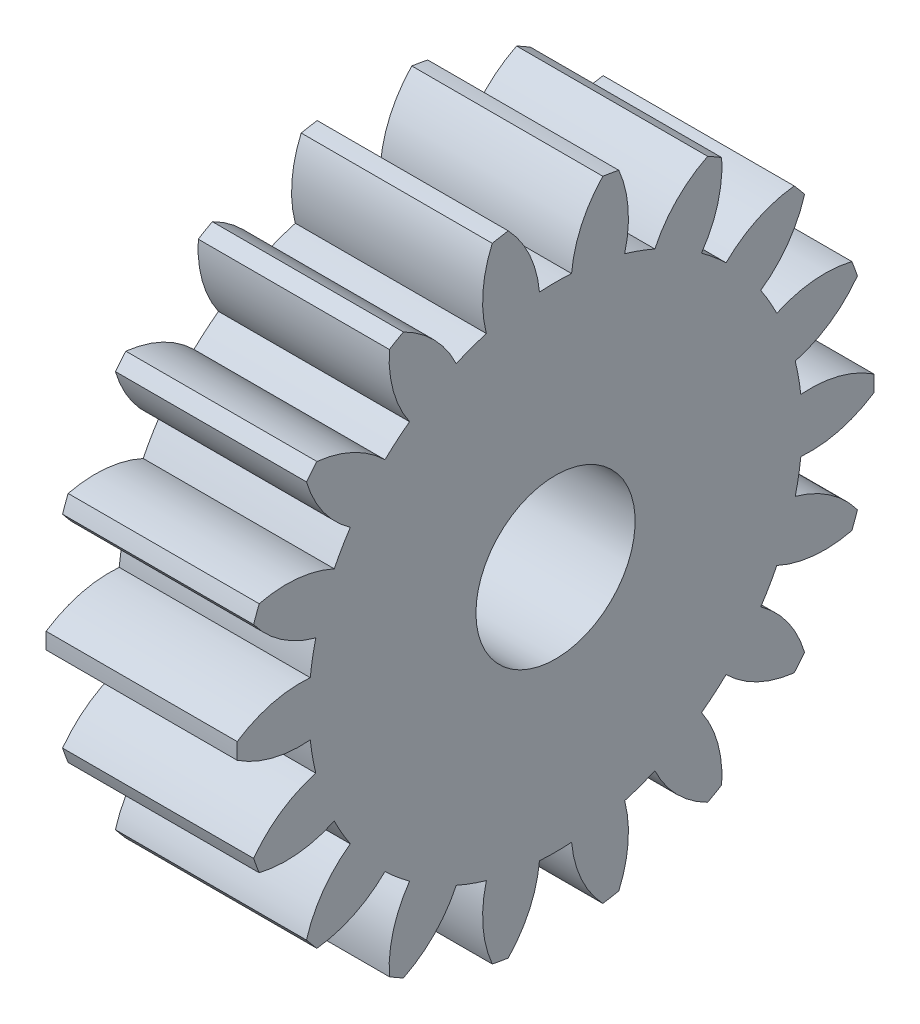
from build123d import *

# Parameters (mm, degrees)
BASPROSKE_W     = 12
BASPROSKE_H     = 20
TOOTHCUT_DEPTH  = 31.724582991
TEETHCUTS_COUNT = 18
TEETHCUTS_ANGLE = 340
BORSKE_R        = 5
BORE_DEPTH      = 50.0000508


with BuildPart() as part:
    # BasProSke → Base-Revolve (revolve)
    with BuildSketch(Plane(origin=(0, 0, 0), x_dir=(1, 0, 0), z_dir=(0, 1, 0)), mode=Mode.PRIVATE) as base_revolve_sk:
        with Locations((6, 10)):
            Rectangle(BASPROSKE_W, BASPROSKE_H)
    revolve(base_revolve_sk.sketch.rotate(Axis((-10, 0, 0), (1, 0, 0)), 180), axis=Axis((-10, 0, 0), (1, 0, 0)))

    # TooCutSke → ToothCut (cut, through all)
    with BuildSketch(Plane(origin=(0, 0, 0), x_dir=(0, 0, -1), z_dir=(1, 0, 0))):
        with BuildLine():
            ThreePointArc((1.007799284, 15.466199973), (0, 15.499), (-1.007799284, 15.466199973))
            ThreePointArc((-1.007799284, 15.466199973), (-1.630454606, 17.802374148), (-2.991345877, 19.800719558))
            ThreePointArc((-2.991345877, 19.800719558), (0, 20.0254), (2.991345877, 19.800719558))
            ThreePointArc((2.991345877, 19.800719558), (1.630454606, 17.802374148), (1.007799284, 15.466199973))
        make_face()
    toothcut = extrude(amount=TOOTHCUT_DEPTH, mode=Mode.SUBTRACT)

    # TeethCuts: ToothCut ×18 about axis
    teethcuts_axis = Axis((-10, 0, 0), (1, 0, 0))
    for i in range(1, TEETHCUTS_COUNT):
        add(toothcut.rotate(teethcuts_axis, i * TEETHCUTS_ANGLE / (TEETHCUTS_COUNT - 1)), mode=Mode.SUBTRACT)

    # BorSke → Bore (cut, symmetric)
    with BuildSketch(Plane(origin=(0, 0, 0), x_dir=(0, 0, -1), z_dir=(1, 0, 0))):
        with Locations(Location((0, 0, 0), (0, 0, 180))):
            Circle(BORSKE_R)
    extrude(amount=BORE_DEPTH, both=True, mode=Mode.SUBTRACT)


solid = part.part
